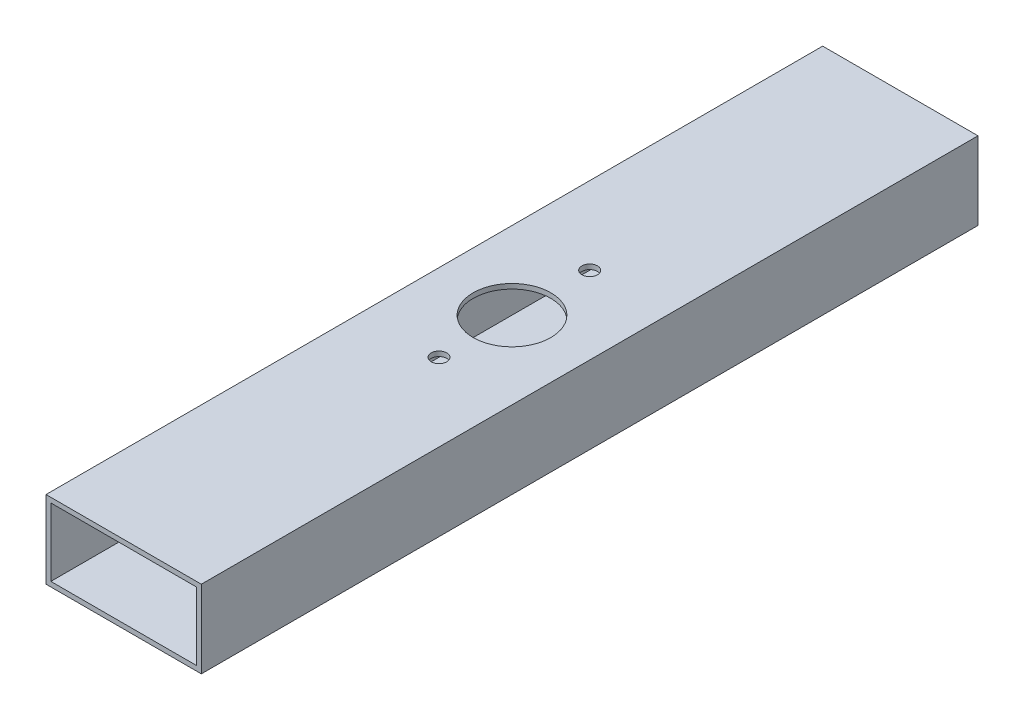
from build123d import *

# Parameters (mm, degrees)
SKETCH1_W           = 50.8
SKETCH1_H           = 25.4
SKETCH1_W_2         = 47.625
SKETCH1_H_2         = 22.225
BOSS_EXTRUDE1_DEPTH = 254
SKETCH2_R           = 12.7
SKETCH2_R_2         = 2.54
CUT_EXTRUDE1_DEPTH  = 257.527425434


with BuildPart() as part:
    # Sketch1 → Boss-Extrude1 (new body)
    with BuildSketch(Plane.XY):
        Rectangle(SKETCH1_W, SKETCH1_H)
        Rectangle(SKETCH1_W_2, SKETCH1_H_2, mode=Mode.SUBTRACT)
    extrude(amount=BOSS_EXTRUDE1_DEPTH)

    # Sketch2 → Cut-Extrude1 (cut, through all)
    with BuildSketch(Plane(origin=(0, 12.7, 0), x_dir=(1, 0, 0), z_dir=(0, 1, 0))):
        with Locations(Location((0, -127, 0), (0, 0, 180))):
            Circle(SKETCH2_R)
        with Locations(Location((0, -101.6, 0), (0, 0, 180))):
            Circle(SKETCH2_R_2)
        with Locations(Location((0, -150.876, 0), (0, 0, 180))):
            Circle(SKETCH2_R_2)
    extrude(amount=-CUT_EXTRUDE1_DEPTH, mode=Mode.SUBTRACT)


solid = part.part
